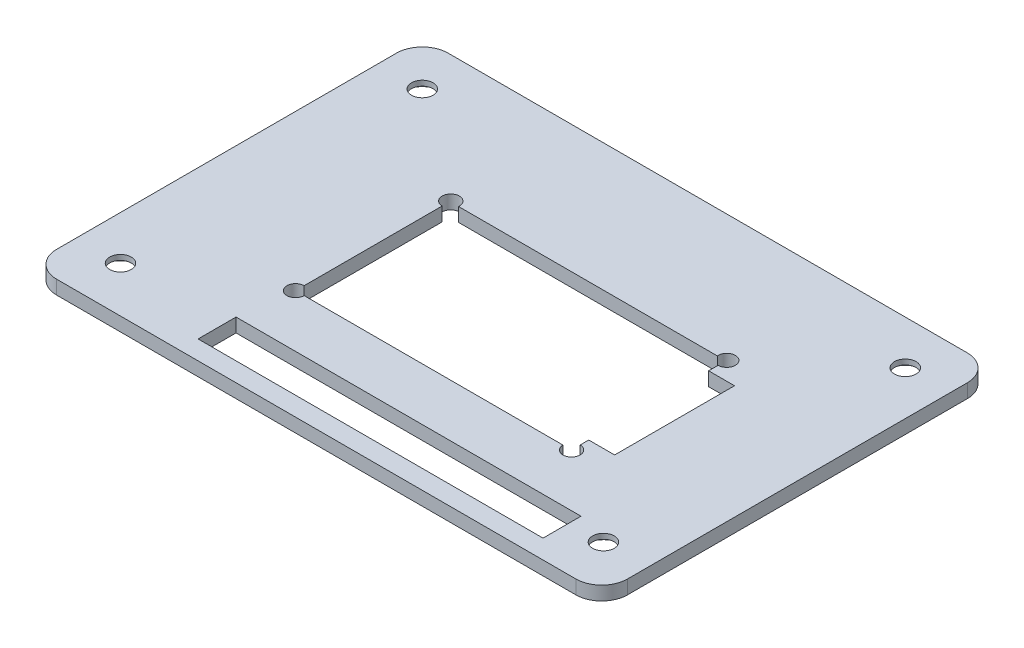
from build123d import *

# Parameters (mm, degrees)
EXTRUDE_1_DEPTH       = 1.6
SKETCH_5_R            = 2.6
CUT_EXTRUDE_855_DEPTH = 1
CUT_EXTRUDE_992_REACH = 42.148
SKETCH_7_R            = 1.25
CUT_EXTRUDE_1_REACH   = 42.168
SKETCH_9_W            = 40
SKETCH_9_H            = 4.4


with BuildPart() as part:
    # 草图1 → 凸台-拉伸1 (new body)
    with BuildSketch(Plane(origin=(0, 0, 0), x_dir=(1, 0, 0), z_dir=(0, 1, 0))):
        with BuildLine():
            Line((-30.1, -22.7), (30.1, -22.7))
            ThreePointArc((30.1, -22.7), (32.221320344, -21.821320344), (33.1, -19.7))
            Line((33.1, -19.7), (33.1, 19.7))
            ThreePointArc((33.1, 19.7), (32.221320344, 21.821320344), (30.1, 22.7))
            Line((30.1, 22.7), (-30.1, 22.7))
            ThreePointArc((-30.1, 22.7), (-32.221320344, 21.821320344), (-33.1, 19.7))
            Line((-33.1, 19.7), (-33.1, -19.7))
            ThreePointArc((-33.1, -19.7), (-32.221320344, -21.821320344), (-30.1, -22.7))
        make_face()
    extrude(amount=EXTRUDE_1_DEPTH)

    # 草图5 → Cut-Extrude 855 (cut)
    with BuildSketch(Plane.XZ):
        with Locations(Location((-28, -17.6, 0), (0, 0, 270))):
            Circle(SKETCH_5_R)
        with Locations(Location((28, -17.6, 0), (0, 0, 270))):
            Circle(SKETCH_5_R)
        with Locations(Location((28, 17.4, 0), (0, 0, 270))):
            Circle(SKETCH_5_R)
        with Locations(Location((-28, 17.4, 0), (0, 0, 270))):
            Circle(SKETCH_5_R)
    extrude(amount=-CUT_EXTRUDE_855_DEPTH, mode=Mode.SUBTRACT)

    # 草图7 → Cut-Extrude 992 (cut, up to next)
    with BuildSketch(Plane.XZ.offset(-1), mode=Mode.PRIVATE) as cut_extrude_992_sk1:
        with Locations(Location((-28, -17.6, 0), (0, 0, 270))):
            Circle(SKETCH_7_R)
    cut_extrude_992_tool1 = extrude(cut_extrude_992_sk1.sketch, amount=-CUT_EXTRUDE_992_REACH, mode=Mode.PRIVATE) & part.part
    # 草图7 → Cut-Extrude 992 (cut, up to next)
    with BuildSketch(Plane.XZ.offset(-1), mode=Mode.PRIVATE) as cut_extrude_992_sk2:
        with Locations(Location((28, -17.6, 0), (0, 0, 270))):
            Circle(SKETCH_7_R)
    cut_extrude_992_tool2 = extrude(cut_extrude_992_sk2.sketch, amount=-CUT_EXTRUDE_992_REACH, mode=Mode.PRIVATE) & part.part
    # 草图7 → Cut-Extrude 992 (cut, up to next)
    with BuildSketch(Plane.XZ.offset(-1), mode=Mode.PRIVATE) as cut_extrude_992_sk3:
        with Locations(Location((28, 17.4, 0), (0, 0, 270))):
            Circle(SKETCH_7_R)
    cut_extrude_992_tool3 = extrude(cut_extrude_992_sk3.sketch, amount=-CUT_EXTRUDE_992_REACH, mode=Mode.PRIVATE) & part.part
    # 草图7 → Cut-Extrude 992 (cut, up to next)
    with BuildSketch(Plane.XZ.offset(-1), mode=Mode.PRIVATE) as cut_extrude_992_sk4:
        with Locations(Location((-28, 17.4, 0), (0, 0, 270))):
            Circle(SKETCH_7_R)
    cut_extrude_992_tool4 = extrude(cut_extrude_992_sk4.sketch, amount=-CUT_EXTRUDE_992_REACH, mode=Mode.PRIVATE) & part.part
    add(cut_extrude_992_tool1.solids().sort_by_distance((-28, 1, -17.6))[0], mode=Mode.SUBTRACT)
    add(cut_extrude_992_tool2.solids().sort_by_distance((28, 1, -17.6))[0], mode=Mode.SUBTRACT)
    add(cut_extrude_992_tool3.solids().sort_by_distance((28, 1, 17.4))[0], mode=Mode.SUBTRACT)
    add(cut_extrude_992_tool4.solids().sort_by_distance((-28, 1, 17.4))[0], mode=Mode.SUBTRACT)

    # 草图9 → 切除-拉伸1 (cut, up to next)
    with BuildSketch(Plane(origin=(0, 0, 0), x_dir=(-1, 0, 0), z_dir=(0, -1, 0)), mode=Mode.PRIVATE) as cut_extrude_1_sk1:
        with Locations((-4.1, -18.3)):
            Rectangle(SKETCH_9_W, SKETCH_9_H)
    cut_extrude_1_tool1 = extrude(cut_extrude_1_sk1.sketch, amount=-CUT_EXTRUDE_1_REACH, mode=Mode.PRIVATE) & part.part
    # 草图9 → 切除-拉伸1 (cut, up to next)
    with BuildSketch(Plane(origin=(0, 0, 0), x_dir=(-1, 0, 0), z_dir=(0, -1, 0)), mode=Mode.PRIVATE) as cut_extrude_1_sk2:
        with BuildLine():
            Line((-16.900000063, -8), (-16.900000063, -9.000012563))
            ThreePointArc((-16.900000063, -9.000012563), (-17.613889315, -10.705332368), (-15.905012563, -10))
            Line((-15.905012563, -10), (14.1, -10))
            ThreePointArc((14.1, -10), (15.807106781, -10.707106781), (15.1, -9))
            Line((15.1, -9), (15.1, 7))
            ThreePointArc((15.1, 7), (15.770820393, 8.741619849), (14.105012563, 7.9))
            Line((14.105012563, 7.9), (-15.905012563, 7.9))
            ThreePointArc((-15.905012563, 7.9), (-17.57082037, 8.74161987), (-16.900000063, 7))
            Line((-16.900000063, 7), (-16.900000063, 5.9))
            Line((-16.900000063, 5.9), (-19.900000063, 5.9))
            Line((-19.900000063, 5.9), (-19.900000063, -8))
            Line((-19.900000063, -8), (-16.900000063, -8))
        make_face()
    cut_extrude_1_tool2 = extrude(cut_extrude_1_sk2.sketch, amount=-CUT_EXTRUDE_1_REACH, mode=Mode.PRIVATE) & part.part
    add(cut_extrude_1_tool1.solids().sort_by_distance((4.1, 0, 18.3))[0], mode=Mode.SUBTRACT)
    add(cut_extrude_1_tool2.solids().sort_by_distance((2.069376, 0, 1.046434))[0], mode=Mode.SUBTRACT)


solid = part.part
